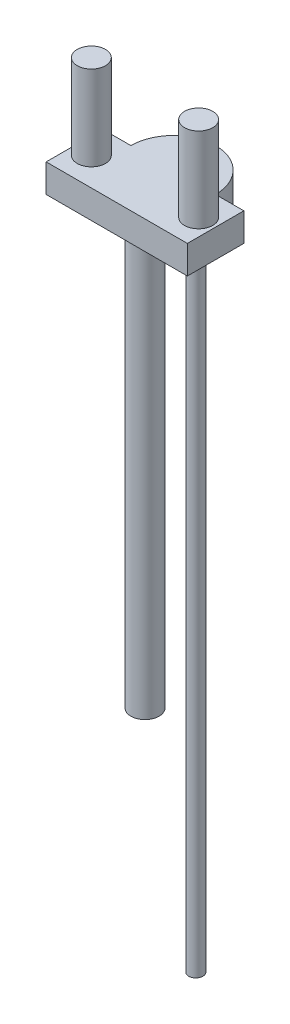
from build123d import *

# Parameters (mm, degrees)
SKETCH1_R           = 5
BOSS_EXTRUDE1_DEPTH = 150
SKETCH2_W           = 50
SKETCH2_H           = 20
BOSS_EXTRUDE2_DEPTH = 10
SKETCH3_R           = 5
BOSS_EXTRUDE3_DEPTH = 30
BOSS_EXTRUDE4_DEPTH = 10
SKETCH5_R           = 2.5
BOSS_EXTRUDE5_DEPTH = 250


with BuildPart() as part:
    # Sketch1 → Boss-Extrude1 (new body)
    with BuildSketch(Plane(origin=(0, 0, 0), x_dir=(1, 0, 0), z_dir=(0, 1, 0))):
        with Locations(Location((0, 0, 0), (0, 0, 270))):
            Circle(SKETCH1_R)
    extrude(amount=BOSS_EXTRUDE1_DEPTH)

    # Sketch2 → Boss-Extrude2 (add)
    with BuildSketch(Plane(origin=(0, 150, 0), x_dir=(1, 0, 0), z_dir=(0, 1, 0))):
        Rectangle(SKETCH2_W, SKETCH2_H)
    extrude(amount=BOSS_EXTRUDE2_DEPTH)

    # Sketch3 → Boss-Extrude3 (add)
    with BuildSketch(Plane(origin=(0, 160, 0), x_dir=(1, 0, 0), z_dir=(0, 1, 0))):
        with Locations(Location((-19, 0, 0), (0, 0, 270))):
            Circle(SKETCH3_R)
        with Locations(Location((19, 0, 0), (0, 0, 270))):
            Circle(SKETCH3_R)
    extrude(amount=BOSS_EXTRUDE3_DEPTH)

    # Sketch4 → Boss-Extrude4 (add)
    with BuildSketch(Plane(origin=(0, 160, 0), x_dir=(1, 0, 0), z_dir=(0, 1, 0))):
        with BuildLine():
            Line((-15, 10), (15, 10))
            ThreePointArc((15, 10), (0, 25), (-15, 10))
        make_face()
    extrude(amount=-BOSS_EXTRUDE4_DEPTH)

    # Sketch5 → Boss-Extrude5 (add)
    with BuildSketch(Plane(origin=(0, 160, 0), x_dir=(1, 0, 0), z_dir=(0, 1, 0))):
        with Locations(Location((0, 18, 0), (0, 0, 270))):
            Circle(SKETCH5_R)
    extrude(amount=-BOSS_EXTRUDE5_DEPTH)


solid = part.part
